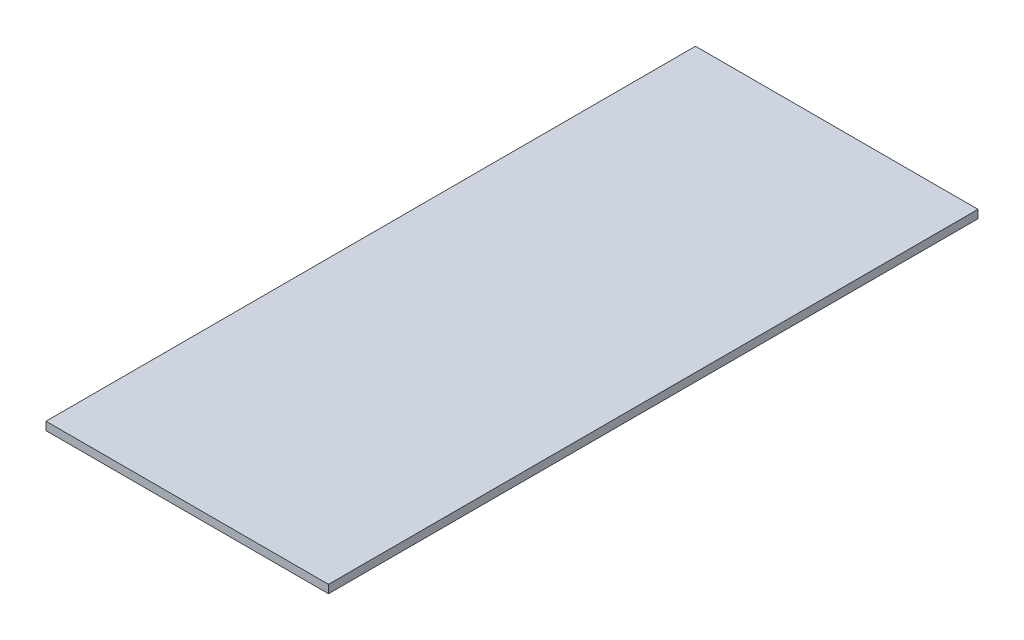
from build123d import *

# Parameters (mm, degrees)
SKETCH1_W           = 27.62
SKETCH1_H           = 63.5
BOSS_EXTRUDE1_DEPTH = 0.8


with BuildPart() as part:
    # Sketch1 → Boss-Extrude1 (new body)
    with BuildSketch(Plane(origin=(0, 0, 0), x_dir=(1, 0, 0), z_dir=(0, 1, 0))):
        Rectangle(SKETCH1_W, SKETCH1_H)
    extrude(amount=BOSS_EXTRUDE1_DEPTH)


solid = part.part
